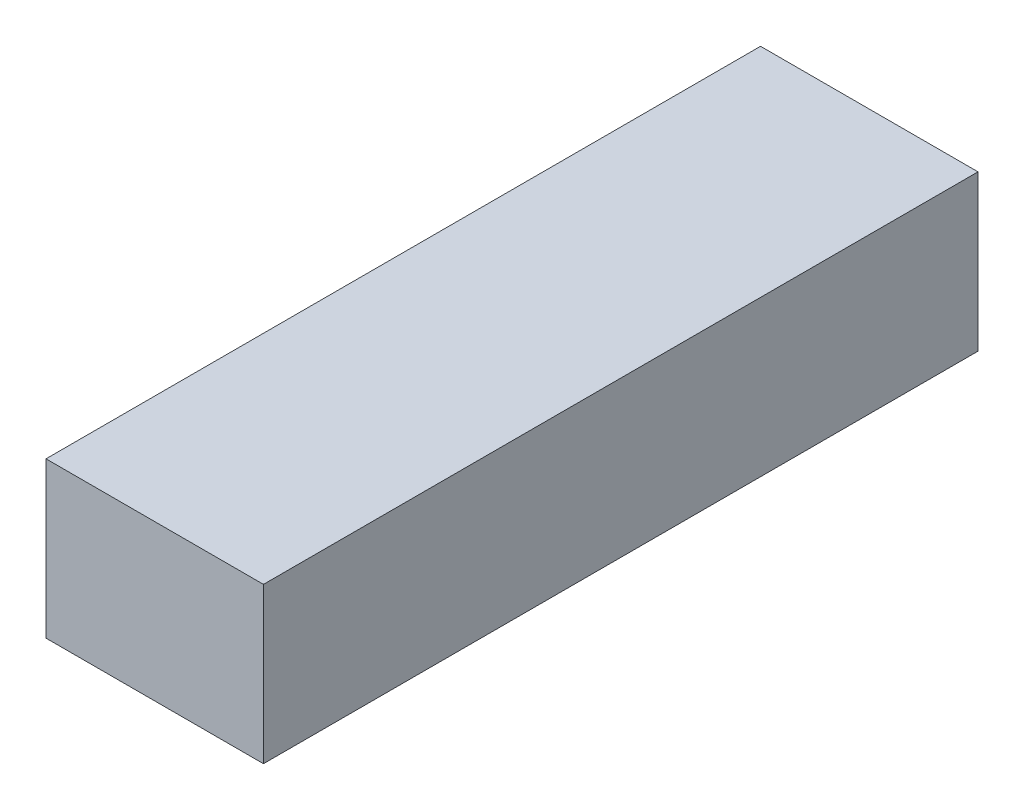
from build123d import *

# Parameters (mm, degrees)
SKETCH1_W           = 35
SKETCH1_H           = 115
BOSS_EXTRUDE1_DEPTH = 25


with BuildPart() as part:
    # Sketch1 → Boss-Extrude1 (new body)
    with BuildSketch(Plane(origin=(0, 0, 0), x_dir=(1, 0, 0), z_dir=(0, 1, 0))):
        Rectangle(SKETCH1_W, SKETCH1_H)
    extrude(amount=BOSS_EXTRUDE1_DEPTH)


solid = part.part
